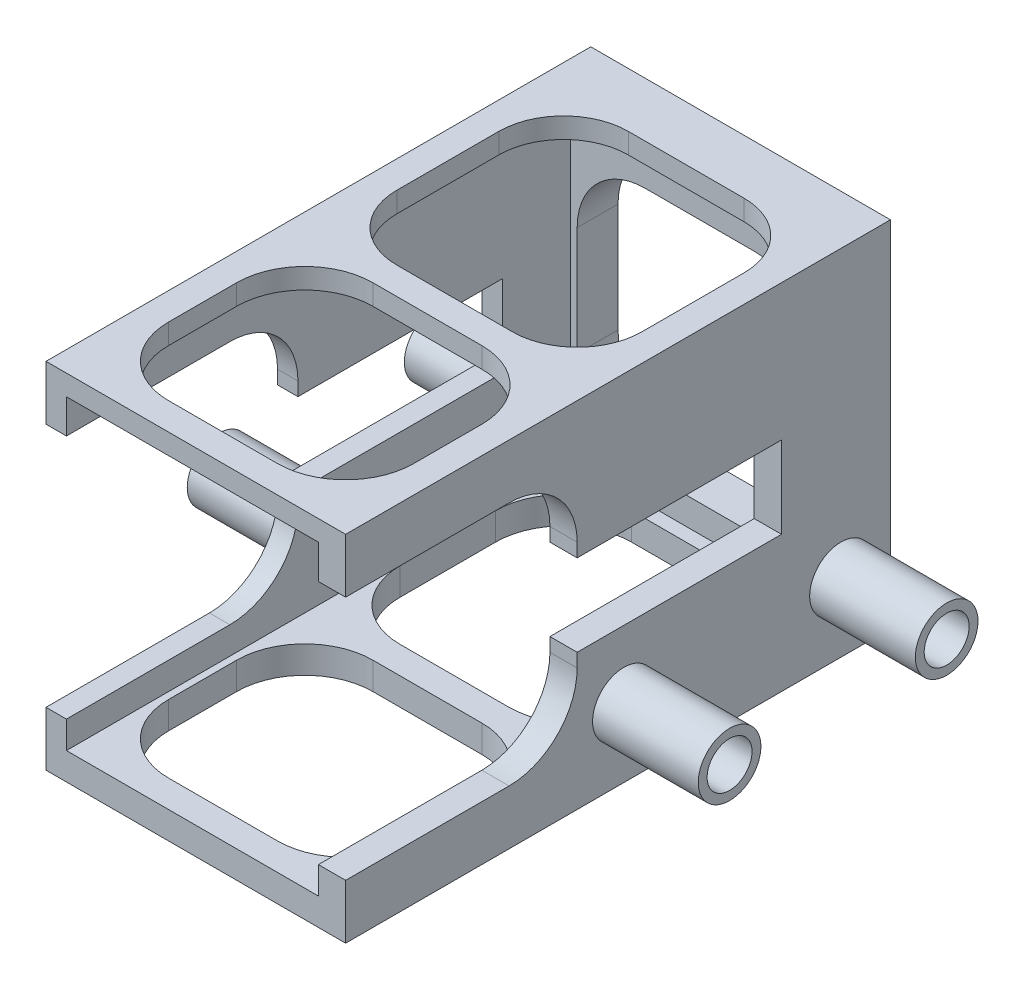
from build123d import *

# Parameters (mm, degrees)
SKETCH1_W           = 22
SKETCH1_H           = 26
BOSS_EXTRUDE1_DEPTH = 40
SKETCH2_W           = 18.5
SKETCH2_H           = 22.5
CUT_EXTRUDE1_DEPTH  = 37
CUT_EXTRUDE2_REACH  = 54.536
CUT_EXTRUDE3_DEPTH  = 2
CUT_EXTRUDE4_START  = -1.5
CUT_EXTRUDE4_DEPTH  = 1.5
CUT_EXTRUDE5_REACH  = 54.536
CUT_EXTRUDE6_REACH  = 54.536
SKETCH12_R          = 2.3
BOSS_EXTRUDE2_DEPTH = 7.76
SKETCH14_R          = 1.65
CUT_EXTRUDE9_DEPTH  = 7.76
SKETCH16_R          = 1.65
CUT_EXTRUDE11_DEPTH = 7.76
BOSS_EXTRUDE3_START = 7.76
SKETCH17_R          = 2.3
BOSS_EXTRUDE3_DEPTH = 7.76
CUT_EXTRUDE12_START = -7.76
SKETCH20_R          = 1.65
CUT_EXTRUDE12_DEPTH = 7.76


with BuildPart() as part:
    # Sketch1 → Boss-Extrude1 (new body)
    with BuildSketch(Plane.XY):
        with Locations((11, 13)):
            Rectangle(SKETCH1_W, SKETCH1_H)
    extrude(amount=BOSS_EXTRUDE1_DEPTH)

    # Sketch2 → Cut-Extrude1 (cut)
    with BuildSketch(Plane.XY.offset(40)):
        with Locations((10.75, 13.25)):
            Rectangle(SKETCH2_W, SKETCH2_H)
    extrude(amount=-CUT_EXTRUDE1_DEPTH, mode=Mode.SUBTRACT)

    # Sketch6 → Cut-Extrude2 (cut, up to next)
    with BuildSketch(Plane(origin=(0, 0, 0), x_dir=(-1, 0, 0), z_dir=(0, 0, -1)), mode=Mode.PRIVATE) as cut_extrude2_sk1:
        with BuildLine():
            Line((-15, 22), (-7, 22))
            ThreePointArc((-7, 22), (-3.464466094, 20.535533906), (-2, 17))
            Line((-2, 17), (-2, 9))
            ThreePointArc((-2, 9), (-3.464466094, 5.464466094), (-7, 4))
            Line((-7, 4), (-15, 4))
            ThreePointArc((-15, 4), (-18.535533906, 5.464466094), (-20, 9))
            Line((-20, 9), (-20, 17))
            ThreePointArc((-20, 17), (-18.535533906, 20.535533906), (-15, 22))
        make_face()
    cut_extrude2_tool1 = extrude(cut_extrude2_sk1.sketch, amount=-CUT_EXTRUDE2_REACH, mode=Mode.PRIVATE) & part.part
    add(cut_extrude2_tool1.solids().sort_by_distance((11, 13, 0))[0], mode=Mode.SUBTRACT)

    # Sketch7 → Cut-Extrude3 (cut)
    with BuildSketch(Plane(origin=(22, 0, 0), x_dir=(0, 0, -1), z_dir=(1, 0, 0))):
        with BuildLine():
            Line((-8, 16), (-23, 16))
            Line((-23, 16), (-23, 17))
            ThreePointArc((-23, 17), (-24.464466094, 20.535533906), (-28, 22))
            Line((-28, 22), (-40, 22))
            Line((-40, 22), (-40, 16))
            Line((-40, 16), (-40, 10))
            Line((-40, 10), (-40, 4))
            Line((-40, 4), (-28, 4))
            ThreePointArc((-28, 4), (-24.464466094, 5.464466094), (-23, 9))
            Line((-23, 9), (-23, 10))
            Line((-23, 10), (-8, 10))
            Line((-8, 10), (-8, 16))
        make_face()
    extrude(amount=-CUT_EXTRUDE3_DEPTH, mode=Mode.SUBTRACT)

    # Sketch8 → Cut-Extrude4 (cut)
    with BuildSketch(Plane.ZY.offset(CUT_EXTRUDE4_START)):
        with BuildLine():
            Line((23, 17), (23, 16))
            Line((23, 16), (8, 16))
            Line((8, 16), (8, 10))
            Line((8, 10), (23, 10))
            Line((23, 10), (23, 9))
            ThreePointArc((23, 9), (24.464466094, 5.464466094), (28, 4))
            Line((28, 4), (40, 4))
            Line((40, 4), (40, 22))
            Line((40, 22), (28, 22))
            ThreePointArc((28, 22), (24.464466094, 20.535533906), (23, 17))
        make_face()
    extrude(amount=CUT_EXTRUDE4_DEPTH, mode=Mode.SUBTRACT)

    # Sketch9 → Cut-Extrude5 (cut, up to next)
    with BuildSketch(Plane(origin=(0, 26, 0), x_dir=(1, 0, 0), z_dir=(0, 1, 0)), mode=Mode.PRIVATE) as cut_extrude5_sk1:
        with BuildLine():
            Line((7, -23), (15, -23))
            ThreePointArc((15, -23), (18.535533906, -24.464466094), (20, -28))
            Line((20, -28), (20, -33))
            ThreePointArc((20, -33), (18.535533906, -36.535533906), (15, -38))
            Line((15, -38), (7, -38))
            ThreePointArc((7, -38), (3.464466094, -36.535533906), (2, -33))
            Line((2, -33), (2, -28))
            ThreePointArc((2, -28), (3.464466094, -24.464466094), (7, -23))
        make_face()
    cut_extrude5_tool1 = extrude(cut_extrude5_sk1.sketch, amount=-CUT_EXTRUDE5_REACH, mode=Mode.PRIVATE) & part.part
    # Sketch9 → Cut-Extrude5 (cut, up to next)
    with BuildSketch(Plane(origin=(0, 26, 0), x_dir=(1, 0, 0), z_dir=(0, 1, 0)), mode=Mode.PRIVATE) as cut_extrude5_sk2:
        with BuildLine():
            Line((2, -16.246572976), (2, -8.753427024))
            ThreePointArc((2, -8.753427024), (3.392246541, -5.392246541), (6.753427024, -4))
            Line((6.753427024, -4), (15.246572976, -4))
            ThreePointArc((15.246572976, -4), (18.607753459, -5.392246541), (20, -8.753427024))
            Line((20, -8.753427024), (20, -16.246572976))
            ThreePointArc((20, -16.246572976), (18.607753459, -19.607753459), (15.246572976, -21))
            Line((15.246572976, -21), (6.753427024, -21))
            ThreePointArc((6.753427024, -21), (3.392246541, -19.607753459), (2, -16.246572976))
        make_face()
    cut_extrude5_tool2 = extrude(cut_extrude5_sk2.sketch, amount=-CUT_EXTRUDE5_REACH, mode=Mode.PRIVATE) & part.part
    add(cut_extrude5_tool1.solids().sort_by_distance((11, 26, 30.5))[0], mode=Mode.SUBTRACT)
    add(cut_extrude5_tool2.solids().sort_by_distance((11, 26, 12.5))[0], mode=Mode.SUBTRACT)

    # Sketch11 → Cut-Extrude6 (cut, up to next)
    with BuildSketch(Plane.XZ, mode=Mode.PRIVATE) as cut_extrude6_sk1:
        with BuildLine():
            Line((7, 23), (15, 23))
            ThreePointArc((15, 23), (18.535533906, 24.464466094), (20, 28))
            Line((20, 28), (20, 33))
            ThreePointArc((20, 33), (18.535533906, 36.535533906), (15, 38))
            Line((15, 38), (7, 38))
            ThreePointArc((7, 38), (3.464466094, 36.535533906), (2, 33))
            Line((2, 33), (2, 28))
            ThreePointArc((2, 28), (3.464466094, 24.464466094), (7, 23))
        make_face()
    cut_extrude6_tool1 = extrude(cut_extrude6_sk1.sketch, amount=-CUT_EXTRUDE6_REACH, mode=Mode.PRIVATE) & part.part
    # Sketch11 → Cut-Extrude6 (cut, up to next)
    with BuildSketch(Plane.XZ, mode=Mode.PRIVATE) as cut_extrude6_sk2:
        with BuildLine():
            Line((2, 16), (2, 9))
            ThreePointArc((2, 9), (3.464466094, 5.464466094), (7, 4))
            Line((7, 4), (15, 4))
            ThreePointArc((15, 4), (18.535533906, 5.464466094), (20, 9))
            Line((20, 9), (20, 16))
            ThreePointArc((20, 16), (18.535533906, 19.535533906), (15, 21))
            Line((15, 21), (7, 21))
            ThreePointArc((7, 21), (3.464466094, 19.535533906), (2, 16))
        make_face()
    cut_extrude6_tool2 = extrude(cut_extrude6_sk2.sketch, amount=-CUT_EXTRUDE6_REACH, mode=Mode.PRIVATE) & part.part
    add(cut_extrude6_tool1.solids().sort_by_distance((11, 0, 30.5))[0], mode=Mode.SUBTRACT)
    add(cut_extrude6_tool2.solids().sort_by_distance((11, 0, 12.5))[0], mode=Mode.SUBTRACT)

    # Sketch12 → Boss-Extrude2 (add)
    with BuildSketch(Plane.ZY):
        with Locations(Location((3.63, 5.03, 0), (0, 0, 90))):
            Circle(SKETCH12_R)
        with Locations(Location((19.57, 5.03, 0), (0, 0, 90))):
            Circle(SKETCH12_R)
    extrude(amount=BOSS_EXTRUDE2_DEPTH)

    # Sketch14 → Cut-Extrude9 (cut)
    with BuildSketch(Plane.ZY.offset(7.76)):
        with Locations(Location((3.63, 5.03, 0), (0, 0, 270))):
            Circle(SKETCH14_R)
    extrude(amount=-CUT_EXTRUDE9_DEPTH, mode=Mode.SUBTRACT)

    # Sketch16 → Cut-Extrude11 (cut)
    with BuildSketch(Plane.ZY.offset(7.76)):
        with Locations(Location((19.57, 5.03, 0), (0, 0, 270))):
            Circle(SKETCH16_R)
    extrude(amount=-CUT_EXTRUDE11_DEPTH, mode=Mode.SUBTRACT)

    # Sketch17 → Boss-Extrude3 (add)
    with BuildSketch(Plane(origin=(22, 0, 0), x_dir=(0, 0, -1), z_dir=(1, 0, 0)).offset(BOSS_EXTRUDE3_START)):
        with Locations(Location((-3.63, 5.03, 0), (0, 0, 90))):
            Circle(SKETCH17_R)
        with Locations(Location((-19.57, 5.03, 0), (0, 0, 90))):
            Circle(SKETCH17_R)
    extrude(amount=-BOSS_EXTRUDE3_DEPTH)

    # Sketch20 → Cut-Extrude12 (cut)
    with BuildSketch(Plane(origin=(29.76, 0, 0), x_dir=(0, 0, -1), z_dir=(1, 0, 0)).offset(CUT_EXTRUDE12_START)):
        with Locations(Location((-3.63, 5.03, 0), (0, 0, 270))):
            Circle(SKETCH20_R)
        with Locations(Location((-19.57, 5.03, 0), (0, 0, 270))):
            Circle(SKETCH20_R)
    extrude(amount=CUT_EXTRUDE12_DEPTH, mode=Mode.SUBTRACT)


solid = part.part
